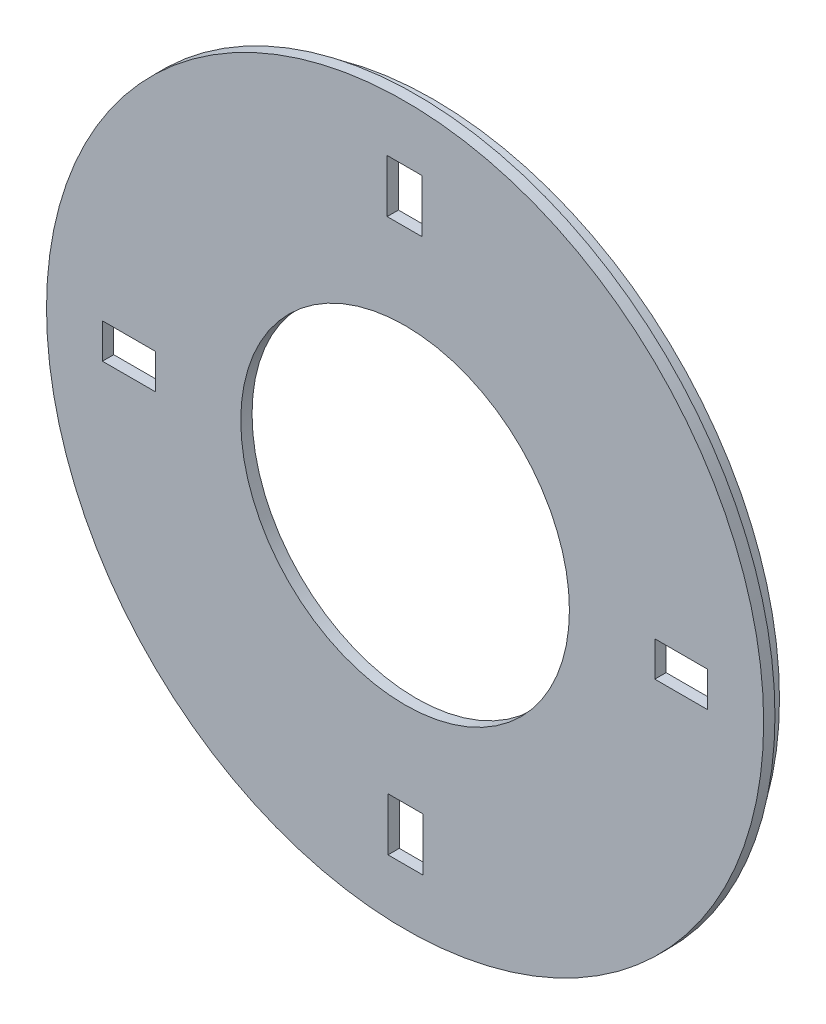
from build123d import *

# Parameters (mm, degrees)
SKETCH1_R           = 63.5
SKETCH1_R_2         = 29.1
SKETCH1_W           = 9.3726
SKETCH1_H           = 6.1976
SKETCH1_W_2         = 6.1976
SKETCH1_H_2         = 9.3726
BOSS_EXTRUDE1_DEPTH = 2
SKETCH2_R           = 61.3
SKETCH2_R_2         = 59.8
BOSS_EXTRUDE2_DEPTH = 3


with BuildPart() as part:
    # Sketch1 → Boss-Extrude1 (new body)
    with BuildSketch(Plane(origin=(0, 0, 0), x_dir=(0, 1, 0), z_dir=(0, 0, 1))):
        with Locations(Location((0, 0, 0), (0, 0, 270))):
            Circle(SKETCH1_R)
        with Locations(Location((0, 0, 0), (0, 0, 270))):
            Circle(SKETCH1_R_2, mode=Mode.SUBTRACT)
        with Locations((48.905920984, 0.073333248)):
            Rectangle(SKETCH1_W, SKETCH1_H, mode=Mode.SUBTRACT)
        with Locations((-0.073333248, 48.905920984)):
            Rectangle(SKETCH1_W_2, SKETCH1_H_2, mode=Mode.SUBTRACT)
        with Locations((0.073333248, -48.905920984)):
            Rectangle(SKETCH1_W_2, SKETCH1_H_2, mode=Mode.SUBTRACT)
        with Locations((-48.905920984, -0.073333248)):
            Rectangle(SKETCH1_W, SKETCH1_H, mode=Mode.SUBTRACT)
    extrude(amount=BOSS_EXTRUDE1_DEPTH)

    # Sketch2 → Boss-Extrude2 (add)
    with BuildSketch(Plane(origin=(0, 0, 0), x_dir=(1, 0, 0), z_dir=(0, 0, -1))):
        Circle(SKETCH2_R)
        with Locations(Location((0, 0, 0), (0, 0, 180))):
            Circle(SKETCH2_R_2, mode=Mode.SUBTRACT)
    extrude(amount=BOSS_EXTRUDE2_DEPTH)


solid = part.part
